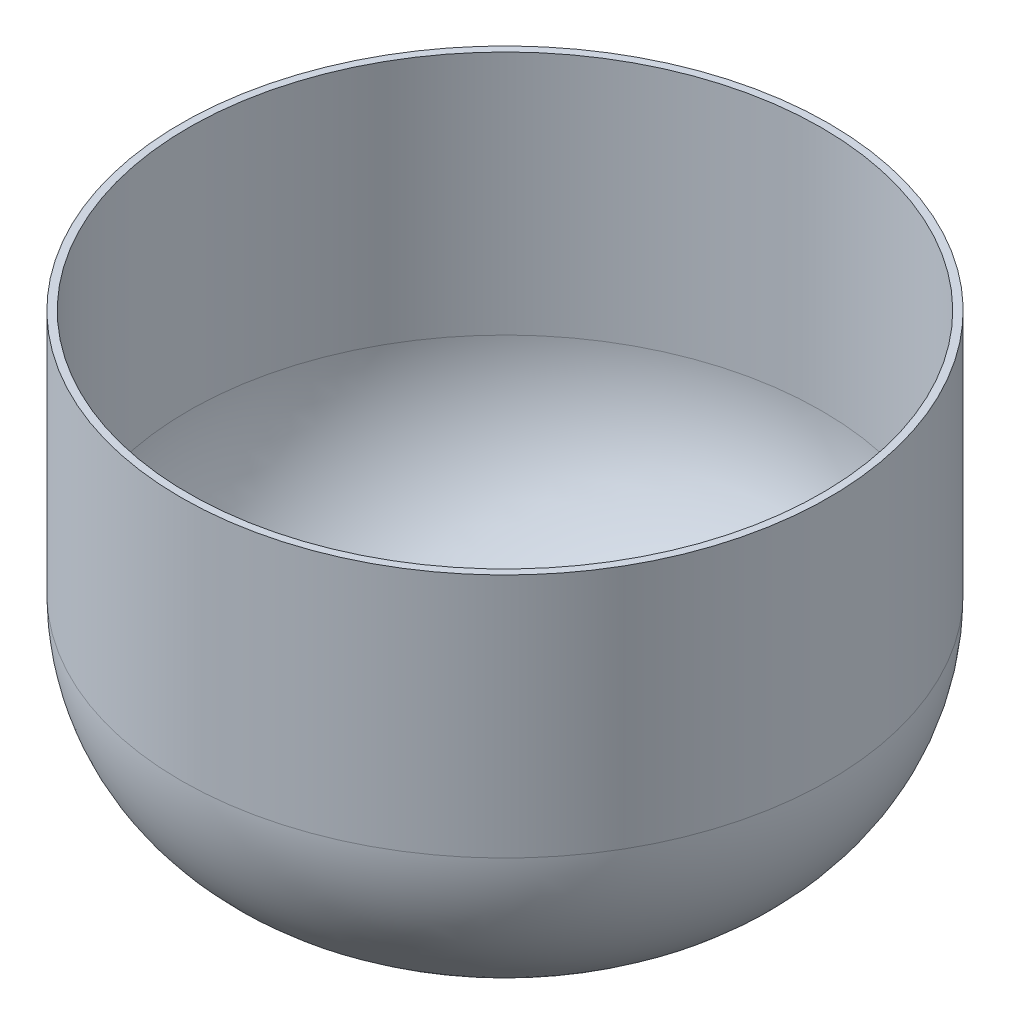
from build123d import *


with BuildPart() as part:
    # Çizim1 → Döndür1 (revolve)
    with BuildSketch(Plane.XY, mode=Mode.PRIVATE) as d_nd_r1_sk:
        with BuildLine():
            Line((-64.5, 44.27684507), (-64.5, -5.66315493))
            ThreePointArc((-64.5, -5.66315493), (-60.056829884, -23.834624811), (-47.729948316, -37.905590277))
            ThreePointArc((-47.729948316, -37.905590277), (-45.330140403, -39.15287303), (-42.66, -39.58315493))
            Line((-42.66, -39.58315493), (-41.66, -39.58315493))
            Line((-41.66, -39.58315493), (-41.66, -40.33315493))
            Line((-41.66, -40.33315493), (-42.66, -40.33315493))
            Line((-42.66, -40.33315493), (-42.66, -41.08315493))
            ThreePointArc((-42.66, -41.08315493), (-45.791233173, -40.580279695), (-48.607542423, -39.122230693))
            ThreePointArc((-48.607542423, -39.122230693), (-61.392201024, -24.51791117), (-66, -5.66315493))
            Line((-66, -5.66315493), (-66, 44.27684507))
            Line((-66, 44.27684507), (-64.5, 44.27684507))
        make_face()
    revolve(d_nd_r1_sk.sketch.rotate(Axis((0, 0, 0), (0, 1, 0)), 270), axis=Axis((0, 0, 0), (0, 1, 0)))


solid = part.part
